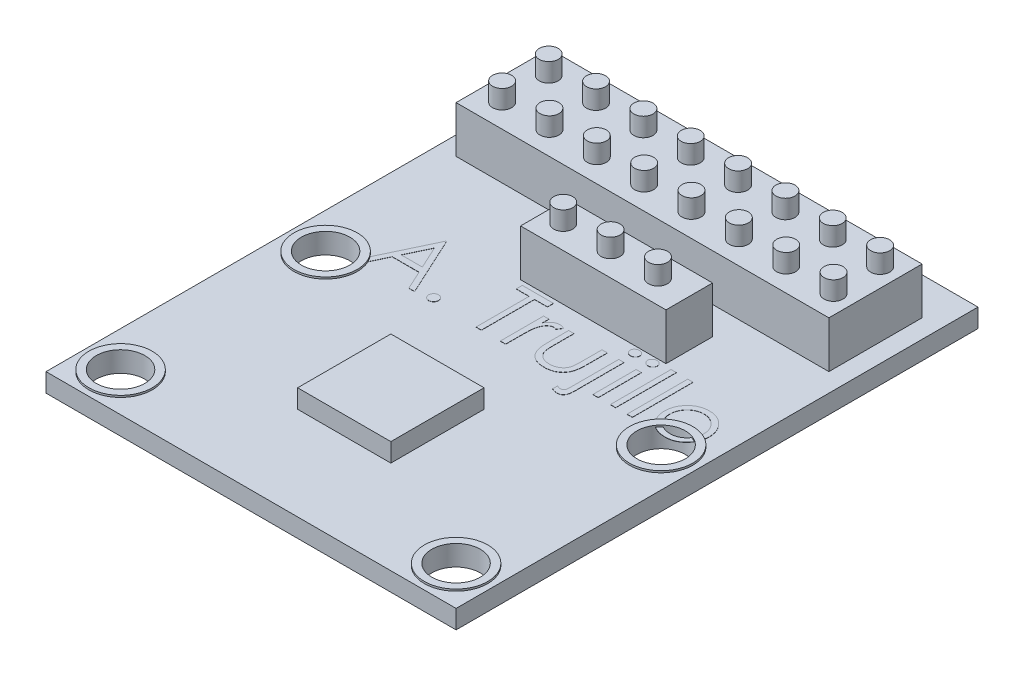
from build123d import *

# Parameters (mm, degrees)
SKETCH1_W           = 22
SKETCH1_H           = 28
BOSS_EXTRUDE1_DEPTH = 1
SKETCH2_W           = 20
SKETCH2_H           = 5
BOSS_EXTRUDE2_DEPTH = 2.5
SKETCH3_R           = 0.51
BOSS_EXTRUDE3_DEPTH = 1
SKETCH4_W           = 5
SKETCH4_H           = 5
BOSS_EXTRUDE4_DEPTH = 1
SKETCH5_R           = 1.3
CUT_EXTRUDE1_DEPTH  = 1
BOSS_EXTRUDE5_START = 0.1
SKETCH6_R           = 1.7
SKETCH6_R_2         = 1.3
BOSS_EXTRUDE5_DEPTH = 0.1
SKETCH7_W           = 7.8
SKETCH7_H           = 2.5
BOSS_EXTRUDE6_DEPTH = 2.5
SKETCH8_R           = 0.51
BOSS_EXTRUDE7_DEPTH = 1
SKETCH9_W           = 0.284935898
SKETCH9_H           = 2.320192308
SKETCH9_W_2         = 0.284935897
SKETCH9_H_2         = 3.256410256
BOSS_EXTRUDE8_DEPTH = 0.01


with BuildPart() as part:
    # Sketch1 → Boss-Extrude1 (new body)
    with BuildSketch(Plane(origin=(0, 0, 0), x_dir=(1, 0, 0), z_dir=(0, 1, 0))):
        Rectangle(SKETCH1_W, SKETCH1_H)
    extrude(amount=BOSS_EXTRUDE1_DEPTH)

    # Sketch2 → Boss-Extrude2 (add)
    with BuildSketch(Plane(origin=(0, 1, 0), x_dir=(1, 0, 0), z_dir=(0, 1, 0))):
        with Locations((0, 9.5)):
            Rectangle(SKETCH2_W, SKETCH2_H)
    extrude(amount=BOSS_EXTRUDE2_DEPTH)

    # Sketch3 → Boss-Extrude3 (add)
    with BuildSketch(Plane(origin=(0, 3.5, 0), x_dir=(1, 0, 0), z_dir=(0, 1, 0))):
        with Locations(Location((9, 8.25, 0), (0, 0, 270))):
            Circle(SKETCH3_R)
        with Locations(Location((6.46, 8.25, 0), (0, 0, 270))):
            Circle(SKETCH3_R)
        with Locations(Location((3.92, 8.25, 0), (0, 0, 270))):
            Circle(SKETCH3_R)
        with Locations(Location((1.38, 8.25, 0), (0, 0, 270))):
            Circle(SKETCH3_R)
        with Locations(Location((-1.16, 8.25, 0), (0, 0, 270))):
            Circle(SKETCH3_R)
        with Locations(Location((-3.7, 8.25, 0), (0, 0, 270))):
            Circle(SKETCH3_R)
        with Locations(Location((-6.24, 8.25, 0), (0, 0, 270))):
            Circle(SKETCH3_R)
        with Locations(Location((-8.78, 8.25, 0), (0, 0, 270))):
            Circle(SKETCH3_R)
        with Locations(Location((-8.78, 10.75, 0), (0, 0, 90))):
            Circle(SKETCH3_R)
        with Locations(Location((-6.24, 10.75, 0), (0, 0, 90))):
            Circle(SKETCH3_R)
        with Locations(Location((-3.7, 10.75, 0), (0, 0, 90))):
            Circle(SKETCH3_R)
        with Locations(Location((-1.16, 10.75, 0), (0, 0, 90))):
            Circle(SKETCH3_R)
        with Locations(Location((1.38, 10.75, 0), (0, 0, 90))):
            Circle(SKETCH3_R)
        with Locations(Location((3.92, 10.75, 0), (0, 0, 90))):
            Circle(SKETCH3_R)
        with Locations(Location((6.46, 10.75, 0), (0, 0, 90))):
            Circle(SKETCH3_R)
        with Locations(Location((9, 10.75, 0), (0, 0, 90))):
            Circle(SKETCH3_R)
    extrude(amount=BOSS_EXTRUDE3_DEPTH)

    # Sketch4 → Boss-Extrude4 (add)
    with BuildSketch(Plane(origin=(0, 1, 0), x_dir=(1, 0, 0), z_dir=(0, 1, 0))):
        with Locations((0, -6.5)):
            Rectangle(SKETCH4_W, SKETCH4_H)
    extrude(amount=BOSS_EXTRUDE4_DEPTH)

    # Sketch5 → Cut-Extrude1 (cut)
    with BuildSketch(Plane(origin=(0, 1, 0), x_dir=(1, 0, 0), z_dir=(0, 1, 0))):
        with Locations(Location((-9, -1, 0), (0, 0, 270))):
            Circle(SKETCH5_R)
        with Locations(Location((9, -1, 0), (0, 0, 90))):
            Circle(SKETCH5_R)
        with Locations(Location((9, -12, 0), (0, 0, 270))):
            Circle(SKETCH5_R)
        with Locations(Location((-9, -12, 0), (0, 0, 90))):
            Circle(SKETCH5_R)
    extrude(amount=-CUT_EXTRUDE1_DEPTH, mode=Mode.SUBTRACT)

    # Sketch6 → Boss-Extrude5 (add)
    # profile 1 of 4: a face of its own
    with BuildSketch(Plane(origin=(0, 1, 0), x_dir=(1, 0, 0), z_dir=(0, 1, 0)).offset(BOSS_EXTRUDE5_START)):
        with Locations(Location((-9, -1, 0), (0, 0, 270))):
            Circle(SKETCH6_R)
        with Locations(Location((-9, -1, 0), (0, 0, 270))):
            Circle(SKETCH6_R_2, mode=Mode.SUBTRACT)
    # profile 2 of 4: a face of its own
    with BuildSketch(Plane(origin=(0, 1, 0), x_dir=(1, 0, 0), z_dir=(0, 1, 0)).offset(BOSS_EXTRUDE5_START)):
        with Locations(Location((9, -1, 0), (0, 0, 270))):
            Circle(SKETCH6_R)
        with Locations(Location((9, -1, 0), (0, 0, 270))):
            Circle(SKETCH6_R_2, mode=Mode.SUBTRACT)
    # profile 3 of 4: a face of its own
    with BuildSketch(Plane(origin=(0, 1, 0), x_dir=(1, 0, 0), z_dir=(0, 1, 0)).offset(BOSS_EXTRUDE5_START)):
        with Locations(Location((-9, -12, 0), (0, 0, 270))):
            Circle(SKETCH6_R)
        with Locations(Location((-9, -12, 0), (0, 0, 270))):
            Circle(SKETCH6_R_2, mode=Mode.SUBTRACT)
    # profile 4 of 4: a face of its own
    with BuildSketch(Plane(origin=(0, 1, 0), x_dir=(1, 0, 0), z_dir=(0, 1, 0)).offset(BOSS_EXTRUDE5_START)):
        with Locations(Location((9, -12, 0), (0, 0, 270))):
            Circle(SKETCH6_R)
        with Locations(Location((9, -12, 0), (0, 0, 270))):
            Circle(SKETCH6_R_2, mode=Mode.SUBTRACT)
    extrude(amount=-BOSS_EXTRUDE5_DEPTH)

    # Sketch7 → Boss-Extrude6 (add)
    with BuildSketch(Plane(origin=(0, 1, 0), x_dir=(1, 0, 0), z_dir=(0, 1, 0))):
        with Locations((1.36, 4.25)):
            Rectangle(SKETCH7_W, SKETCH7_H)
    extrude(amount=BOSS_EXTRUDE6_DEPTH)

    # Sketch8 → Boss-Extrude7 (add)
    with BuildSketch(Plane(origin=(0, 3.5, 0), x_dir=(1, 0, 0), z_dir=(0, 1, 0))):
        with Locations(Location((-1.5, 4.25, 0), (0, 0, 270))):
            Circle(SKETCH8_R)
        with Locations(Location((1.04, 4.25, 0), (0, 0, 270))):
            Circle(SKETCH8_R)
        with Locations(Location((3.58, 4.25, 0), (0, 0, 270))):
            Circle(SKETCH8_R)
    extrude(amount=BOSS_EXTRUDE7_DEPTH)

    # Sketch9 → Boss-Extrude8 (add)
    # profile 1 of 12: a face of its own
    with BuildSketch(Plane(origin=(0, 1, 0), x_dir=(1, 0, 0), z_dir=(0, 1, 0))):
        Polygon((-6.290384615, 2.775), (-4.825, -0.4), (-5.134740585, -0.4), (-5.604121595, 0.617628205), (-7.043429487, 0.617628205), (-7.526166867, -0.4), (-7.837179487, -0.4), (-6.331089744, 2.775), align=None)
        Polygon((-6.313917268, 2.156154848), (-6.888877204, 0.943269231), (-5.754221755, 0.943269231), align=None, mode=Mode.SUBTRACT)
    # profile 2 of 12: a face of its own
    with BuildSketch(Plane(origin=(0, 1, 0), x_dir=(1, 0, 0), z_dir=(0, 1, 0))):
        with BuildLine():
            add(Edge.make_bspline(
                [(-4.03125, 0.088461538), (-4.013569593, 0.087410916), (-3.978909223, 0.085351293), (-3.928799442, 0.071221025), (-3.883447144, 0.046130668), (-3.843050036, 0.012690862), (-3.809752018, -0.027854489), (-3.783767498, -0.072845064), (-3.769760319, -0.123374365), (-3.767715699, -0.158235571), (-3.766666667, -0.176121795)],
                knots=[0, 0, 0, 0, 1.020151414, 1.999887582, 2.974338812, 3.990962822, 5.007586832, 5.987933904, 6.967670073, 8, 8, 8, 8], degree=3))
            add(Edge.make_bspline(
                [(-3.766666667, -0.176121795), (-3.767751247, -0.193578244), (-3.769890025, -0.228002105), (-3.78373539, -0.278150289), (-3.80995005, -0.323168981), (-3.842820365, -0.364264492), (-3.88345713, -0.397775139), (-3.928906662, -0.42265203), (-3.978791589, -0.437794041), (-4.013549968, -0.439722896), (-4.03125, -0.440705128)],
                knots=[0, 0, 0, 0, 1.009421747, 1.99056486, 2.972319754, 3.999869655, 5.017953583, 5.993804169, 6.978383603, 8, 8, 8, 8], degree=3))
            add(Edge.make_bspline(
                [(-4.03125, -0.440705128), (-4.048962786, -0.439758436), (-4.083542784, -0.437910246), (-4.133241507, -0.422341129), (-4.178967828, -0.398008419), (-4.219596681, -0.364202008), (-4.252742295, -0.323380449), (-4.277802464, -0.277840248), (-4.292852099, -0.228145659), (-4.294831369, -0.193606518), (-4.295833333, -0.176121795)],
                knots=[0, 0, 0, 0, 1.022052826, 1.995314843, 2.982371812, 4.00089066, 5.028879526, 6.005146991, 6.990147033, 8, 8, 8, 8], degree=3))
            add(Edge.make_bspline(
                [(-4.295833333, -0.176121795), (-4.294869858, -0.158206286), (-4.292988789, -0.123228454), (-4.277770869, -0.073154978), (-4.252936734, -0.027645037), (-4.219367554, 0.012629004), (-4.178977657, 0.0463632), (-4.133351814, 0.070914834), (-4.083423088, 0.085465779), (-4.048942644, 0.087445633), (-4.03125, 0.088461538)],
                knots=[0, 0, 0, 0, 1.032775665, 2.016367738, 2.991239715, 4.008302682, 5.025365648, 6.011011707, 6.979408107, 8, 8, 8, 8], degree=3))
        make_face()
    # profile 3 of 12: a face of its own
    with BuildSketch(Plane(origin=(0, 1, 0), x_dir=(1, 0, 0), z_dir=(0, 1, 0))):
        Polygon((-2.219871795, 2.449358974), (-2.219871795, 2.775), (-0.550961538, 2.775), (-0.550961538, 2.449358974), (-1.242948718, 2.449358974), (-1.242948718, -0.4), (-1.527884615, -0.4), (-1.527884615, 2.449358974), align=None)
    # profile 4 of 12: a face of its own
    with BuildSketch(Plane(origin=(0, 1, 0), x_dir=(1, 0, 0), z_dir=(0, 1, 0))):
        with BuildLine():
            Line((-0.225320513, 1.920192308), (0.059615385, 1.920192308))
            Line((0.059615385, 1.920192308), (0.059615385, 1.578650841))
            add(Edge.make_bspline(
                [(0.059615385, 1.578650841), (0.080650901, 1.610451486), (0.120881164, 1.671269971), (0.187749321, 1.751705694), (0.256241629, 1.818303629), (0.326685978, 1.871374678), (0.399600397, 1.911119436), (0.473384632, 1.940232403), (0.549199522, 1.957447539), (0.60014641, 1.95974593), (0.625671074, 1.960897436)],
                knots=[0, 0, 0, 0, 1.2804753, 2.448899062, 3.506932113, 4.484331642, 5.4025378, 6.288909075, 7.142734305, 8, 8, 8, 8], degree=3))
            add(Edge.make_bspline(
                [(0.625671074, 1.960897436), (0.64547067, 1.959817458), (0.686209626, 1.957595334), (0.747879547, 1.941982657), (0.811418964, 1.917056165), (0.852369558, 1.893615392), (0.873717949, 1.881395232)],
                knots=[0, 0, 0, 0, 0.901110191, 1.854092781, 2.881294221, 4, 4, 4, 4], degree=3))
            Line((0.873717949, 1.881395232), (0.717257612, 1.634620393))
            add(Edge.make_bspline(
                [(0.717257612, 1.634620393), (0.703551572, 1.640734777), (0.677534883, 1.652341049), (0.639476098, 1.666077015), (0.604386599, 1.674165024), (0.582031371, 1.675390318), (0.571609575, 1.675961538)],
                knots=[0, 0, 0, 0, 1.180555205, 2.24091978, 3.179933427, 4, 4, 4, 4], degree=3))
            add(Edge.make_bspline(
                [(0.571609575, 1.675961538), (0.548744374, 1.674437505), (0.502105992, 1.671328917), (0.433630767, 1.64689157), (0.367185088, 1.607407959), (0.31441508, 1.563619165), (0.273555322, 1.521393663), (0.244399546, 1.484519755), (0.217654483, 1.443173425), (0.192100069, 1.398061498), (0.168817073, 1.348413709), (0.147086766, 1.294726079), (0.127439083, 1.236936427), (0.116235648, 1.196675141), (0.110496795, 1.176051683)],
                knots=[0, 0, 0, 0, 1.125678352, 2.296057538, 3.5422874, 4.923748041, 5.663163013, 6.437101912, 7.23742474, 8.08941207, 8.991984279, 9.93940061, 10.944477711, 12, 12, 12, 12], degree=3))
            add(Edge.make_bspline(
                [(0.110496795, 1.176051683), (0.106203838, 1.15765739), (0.096695265, 1.116915428), (0.087450084, 1.048563552), (0.078315593, 0.967806376), (0.071877946, 0.874419109), (0.065910722, 0.768634964), (0.062545148, 0.650292785), (0.059730156, 0.519271102), (0.059654802, 0.427672938), (0.059615385, 0.379757612)],
                knots=[0, 0, 0, 0, 0.566838948, 1.255505196, 2.06880316, 3.007127437, 4.065329342, 5.249902469, 6.561414163, 8, 8, 8, 8], degree=3))
            Line((0.059615385, 0.379757612), (0.059615385, -0.4))
            Line((0.059615385, -0.4), (-0.225320513, -0.4))
            Line((-0.225320513, -0.4), (-0.225320513, 1.920192308))
        make_face()
    # profile 5 of 12: a face of its own
    with BuildSketch(Plane(origin=(0, 1, 0), x_dir=(1, 0, 0), z_dir=(0, 1, 0))):
        with BuildLine():
            Line((1.117948718, 1.920192308), (1.402884615, 1.920192308))
            Line((1.402884615, 1.920192308), (1.402884615, 0.844050481))
            add(Edge.make_bspline(
                [(1.402884615, 0.844050481), (1.403013343, 0.812461273), (1.403259594, 0.752032597), (1.40492959, 0.665078249), (1.408857604, 0.585778803), (1.413768716, 0.514088448), (1.420084368, 0.450019315), (1.42759856, 0.393795184), (1.435997271, 0.34477846), (1.444218447, 0.315256987), (1.448041867, 0.301527444)],
                knots=[0, 0, 0, 0, 1.388932606, 2.656963016, 3.823490214, 4.879454478, 5.816252168, 6.653371382, 7.373723809, 8, 8, 8, 8], degree=3))
            add(Edge.make_bspline(
                [(1.448041867, 0.301527444), (1.454175473, 0.284270982), (1.466315168, 0.250116817), (1.488334685, 0.200778219), (1.515574676, 0.155080642), (1.545383234, 0.111261947), (1.579763411, 0.070620145), (1.618280217, 0.033223867), (1.659644332, -0.002339845), (1.721107818, -0.044417477), (1.805163009, -0.089516384), (1.915519437, -0.128429019), (2.035175413, -0.15168437), (2.117874837, -0.154382444), (2.160381611, -0.155769231)],
                knots=[0, 0, 0, 0, 0.725840625, 1.436591201, 2.137033971, 2.831655856, 3.53531722, 4.242432219, 4.957935707, 5.694543706, 7.190802206, 8.724350549, 10.316345118, 12, 12, 12, 12], degree=3))
            add(Edge.make_bspline(
                [(2.160381611, -0.155769231), (2.202884435, -0.154352955), (2.285119537, -0.151612724), (2.403460831, -0.129130514), (2.5116389, -0.091569639), (2.608567977, -0.039130058), (2.693808418, 0.025043099), (2.764841712, 0.100343946), (2.823449721, 0.184390176), (2.849039696, 0.247095772), (2.861909054, 0.278630809)],
                knots=[0, 0, 0, 0, 1.157059328, 2.238695713, 3.266970494, 4.264342957, 5.228770407, 6.160125903, 7.074715775, 8, 8, 8, 8], degree=3))
            add(Edge.make_bspline(
                [(2.861909054, 0.278630809), (2.86571382, 0.291300237), (2.874125228, 0.319309249), (2.883162504, 0.366825163), (2.891303623, 0.423489483), (2.898255219, 0.489673001), (2.903212902, 0.565202761), (2.905885369, 0.650055158), (2.90890459, 0.743963821), (2.908950415, 0.809702431), (2.908974359, 0.844050481)],
                knots=[0, 0, 0, 0, 0.557542046, 1.232589297, 2.036731608, 2.971723315, 4.038036528, 5.22795436, 6.551621927, 8, 8, 8, 8], degree=3))
            Line((2.908974359, 0.844050481), (2.908974359, 1.920192308))
            Line((2.908974359, 1.920192308), (3.193910256, 1.920192308))
            Line((3.193910256, 1.920192308), (3.193910256, 0.790625))
            add(Edge.make_bspline(
                [(3.193910256, 0.790625), (3.193509576, 0.752246352), (3.192732202, 0.677786524), (3.187736254, 0.569578794), (3.179164106, 0.468738758), (3.166153241, 0.375213037), (3.150853665, 0.289073036), (3.131117617, 0.210208352), (3.107551645, 0.138861971), (3.080967356, 0.073781931), (3.049560376, 0.014775105), (3.016153008, -0.0412281), (2.977576965, -0.092838119), (2.936963966, -0.142624058), (2.89178675, -0.188109587), (2.842891878, -0.230338425), (2.790967547, -0.269956104), (2.734861489, -0.305417479), (2.675392775, -0.337364007), (2.61248799, -0.36568145), (2.545376656, -0.388090216), (2.474924642, -0.407422034), (2.400786778, -0.422584446), (2.323034536, -0.433276545), (2.241694106, -0.439830953), (2.186259096, -0.440408843), (2.15783754, -0.440705128)],
                knots=[0, 0, 0, 0, 1.493040784, 2.896703357, 4.213163133, 5.428574705, 6.569057535, 7.615249723, 8.588095153, 9.490268104, 10.346124644, 11.18633936, 12.024365274, 12.850166724, 13.684164916, 14.514361689, 15.362232829, 16.222528818, 17.093394965, 17.986930858, 18.902426812, 19.842810585, 20.827885679, 21.843828298, 22.894529745, 24, 24, 24, 24], degree=3))
            add(Edge.make_bspline(
                [(2.15783754, -0.440705128), (2.129628559, -0.440396965), (2.074195286, -0.439791396), (1.992850658, -0.433312757), (1.914882993, -0.422601059), (1.840569489, -0.407310969), (1.769835571, -0.388225527), (1.702394725, -0.365543748), (1.639036636, -0.337349311), (1.579000104, -0.30561967), (1.52275508, -0.269728313), (1.470042299, -0.230387306), (1.42093244, -0.187655377), (1.375414671, -0.141710989), (1.334127899, -0.091984196), (1.296557633, -0.03887501), (1.262125479, 0.017090342), (1.23096259, 0.077019068), (1.204191212, 0.142852249), (1.180555382, 0.215693187), (1.161223589, 0.29634047), (1.145491492, 0.384725148), (1.132835543, 0.480424221), (1.124048828, 0.583991284), (1.119135896, 0.695174061), (1.118352976, 0.771963605), (1.117948718, 0.811613582)],
                knots=[0, 0, 0, 0, 1.083640291, 2.129454052, 3.13281866, 4.105697902, 5.042300162, 5.946461698, 6.836384745, 7.703652036, 8.553297018, 9.397182691, 10.228592656, 11.052265423, 11.879314572, 12.708807002, 13.549817954, 14.402308542, 15.300838682, 16.27712199, 17.341985831, 18.484375296, 19.725102775, 21.0496083, 22.476576903, 24, 24, 24, 24], degree=3))
            Line((1.117948718, 0.811613582), (1.117948718, 1.920192308))
        make_face()
    # profile 6 of 12: a face of its own
    with BuildSketch(Plane(origin=(0, 1, 0), x_dir=(1, 0, 0), z_dir=(0, 1, 0))):
        with BuildLine():
            add(Edge.make_bspline(
                [(3.946955128, 2.897115385), (3.964844632, 2.896301242), (3.999673067, 2.894716217), (4.049844476, 2.881099846), (4.094985299, 2.857386423), (4.135408102, 2.826583645), (4.169313863, 2.789305864), (4.193927924, 2.746840161), (4.208489214, 2.700234886), (4.210508366, 2.668038142), (4.211538462, 2.65161258)],
                knots=[0, 0, 0, 0, 1.06928763, 2.081757757, 3.080304056, 4.102817284, 5.108909582, 6.075019406, 7.017947647, 8, 8, 8, 8], degree=3))
            add(Edge.make_bspline(
                [(4.211538462, 2.65161258), (4.210488325, 2.63561376), (4.20841659, 2.604050893), (4.193938765, 2.558247277), (4.169108267, 2.516376936), (4.135430802, 2.479171593), (4.09497934, 2.448386481), (4.04984607, 2.424668402), (3.999672639, 2.411053277), (3.964844487, 2.409468078), (3.946955128, 2.408653846)],
                knots=[0, 0, 0, 0, 0.962634111, 1.899108286, 2.860048811, 3.872254101, 4.900980094, 5.905593535, 6.924215405, 8, 8, 8, 8], degree=3))
            add(Edge.make_bspline(
                [(3.946955128, 2.408653846), (3.929065769, 2.409468078), (3.894237617, 2.411053277), (3.844064186, 2.424668402), (3.798930916, 2.448386481), (3.758479455, 2.479171593), (3.72480199, 2.516376936), (3.699971492, 2.558247277), (3.685493667, 2.604050893), (3.683421931, 2.63561376), (3.682371795, 2.65161258)],
                knots=[0, 0, 0, 0, 1.075784595, 2.094406465, 3.099019906, 4.127745899, 5.139951189, 6.100891714, 7.037365889, 8, 8, 8, 8], degree=3))
            add(Edge.make_bspline(
                [(3.682371795, 2.65161258), (3.68340189, 2.668038142), (3.685421042, 2.700234886), (3.699982332, 2.746840161), (3.724596393, 2.789305864), (3.758502154, 2.826583645), (3.798924958, 2.857386423), (3.844065781, 2.881099846), (3.89423719, 2.894716217), (3.929065624, 2.896301242), (3.946955128, 2.897115385)],
                knots=[0, 0, 0, 0, 0.982052353, 1.924980594, 2.891090418, 3.897182716, 4.919695944, 5.918242243, 6.93071237, 8, 8, 8, 8], degree=3))
        make_face()
    # profile 7 of 12: a face of its own
    with BuildSketch(Plane(origin=(0, 1, 0), x_dir=(1, 0, 0), z_dir=(0, 1, 0))):
        with BuildLine():
            Line((3.804487179, 1.920192308), (4.089423077, 1.920192308))
            Line((4.089423077, 1.920192308), (4.089423077, -0.738997396))
            add(Edge.make_bspline(
                [(4.089423077, -0.738997396), (4.089332128, -0.762543685), (4.089157362, -0.807790032), (4.08355857, -0.873126571), (4.076295731, -0.933703109), (4.065705325, -0.989449357), (4.051692947, -1.040319581), (4.034491536, -1.085988372), (4.015142869, -1.127421868), (3.991180759, -1.163108424), (3.965126068, -1.194427666), (3.936750989, -1.221527429), (3.906210926, -1.244748826), (3.872788376, -1.262979637), (3.837570782, -1.278101428), (3.799803261, -1.287846972), (3.760003002, -1.294698271), (3.73264868, -1.295236754), (3.7186248, -1.295512821)],
                knots=[0, 0, 0, 0, 1.493029139, 2.868991889, 4.156754484, 5.362105958, 6.464967428, 7.499106053, 8.455465818, 9.358121702, 10.217355437, 11.035397588, 11.842309395, 12.643033568, 13.444773531, 14.266895717, 15.11148054, 16, 16, 16, 16], degree=3))
            add(Edge.make_bspline(
                [(3.7186248, -1.295512821), (3.693966134, -1.294660842), (3.643002913, -1.292900019), (3.564737446, -1.277501864), (3.481894906, -1.254874533), (3.426311346, -1.233483404), (3.397435897, -1.222370793)],
                knots=[0, 0, 0, 0, 0.892368802, 1.844300437, 2.88012224, 4, 4, 4, 4], degree=3))
            Line((3.397435897, -1.222370793), (3.397435897, -0.948247196))
            add(Edge.make_bspline(
                [(3.397435897, -0.948247196), (3.41545271, -0.957855682), (3.449830753, -0.976189721), (3.50244422, -0.994748605), (3.551728083, -1.008347444), (3.584131659, -1.009853719), (3.599689503, -1.010576923)],
                knots=[0, 0, 0, 0, 1.144578483, 2.183980519, 3.128079311, 4, 4, 4, 4], degree=3))
            add(Edge.make_bspline(
                [(3.599689503, -1.010576923), (3.617677073, -1.009421716), (3.652367083, -1.007193836), (3.700738004, -0.987968404), (3.741514316, -0.955337613), (3.76033218, -0.926010723), (3.770142228, -0.910722155)],
                knots=[0, 0, 0, 0, 1.036054724, 1.998088038, 2.956371939, 4, 4, 4, 4], degree=3))
            add(Edge.make_bspline(
                [(3.770142228, -0.910722155), (3.775712416, -0.897297287), (3.788746637, -0.86588314), (3.797650118, -0.807107044), (3.803895746, -0.732378348), (3.804277615, -0.676696339), (3.804487179, -0.646138822)],
                knots=[0, 0, 0, 0, 0.647276487, 1.514624746, 2.636060416, 4, 4, 4, 4], degree=3))
            Line((3.804487179, -0.646138822), (3.804487179, 1.920192308))
        make_face()
    # profile 8 of 12: a face of its own
    with BuildSketch(Plane(origin=(0, 1, 0), x_dir=(1, 0, 0), z_dir=(0, 1, 0))):
        with BuildLine():
            add(Edge.make_bspline(
                [(4.881901042, 2.897115385), (4.89958245, 2.896295189), (4.934206042, 2.894689089), (4.984274221, 2.880935463), (5.02986451, 2.857622177), (5.070302882, 2.826344181), (5.105002808, 2.789560043), (5.129296738, 2.746687593), (5.14491084, 2.700370114), (5.146796387, 2.66806214), (5.14775641, 2.65161258)],
                knots=[0, 0, 0, 0, 1.055194115, 2.066272739, 3.074728998, 4.095836921, 5.109056067, 6.073838105, 7.019297344, 8, 8, 8, 8], degree=3))
            add(Edge.make_bspline(
                [(5.14775641, 2.65161258), (5.146774737, 2.63559003), (5.144834084, 2.603915346), (5.129308798, 2.558400839), (5.104795768, 2.516124096), (5.070325133, 2.479411381), (5.029858614, 2.448150675), (4.984275787, 2.424832805), (4.93420563, 2.411080395), (4.89958231, 2.409474127), (4.881901042, 2.408653846)],
                knots=[0, 0, 0, 0, 0.96129708, 1.900370562, 2.859976407, 3.87933698, 4.906634145, 5.921202961, 6.938410037, 8, 8, 8, 8], degree=3))
            add(Edge.make_bspline(
                [(4.881901042, 2.408653846), (4.864421963, 2.409442807), (4.830401221, 2.410978415), (4.781082729, 2.425102646), (4.735881171, 2.448158655), (4.695363932, 2.479206694), (4.661590828, 2.516349565), (4.637008776, 2.558375039), (4.621519346, 2.603921915), (4.619573861, 2.635592237), (4.618589744, 2.65161258)],
                knots=[0, 0, 0, 0, 1.054934014, 2.053291228, 3.073705704, 4.106921865, 5.123545215, 6.088680038, 7.033164197, 8, 8, 8, 8], degree=3))
            add(Edge.make_bspline(
                [(4.618589744, 2.65161258), (4.619552301, 2.668059851), (4.621442824, 2.700363328), (4.637020386, 2.746713822), (4.661386069, 2.789332756), (4.695386294, 2.826548745), (4.735875219, 2.857614247), (4.781084267, 2.880665637), (4.830400815, 2.894791066), (4.864421826, 2.896326509), (4.881901042, 2.897115385)],
                knots=[0, 0, 0, 0, 0.98631895, 1.937192651, 2.907499808, 3.917963147, 4.944918757, 5.95915025, 6.951458133, 8, 8, 8, 8], degree=3))
        make_face()
    # profile 9 of 12: a face of its own
    with BuildSketch(Plane(origin=(0, 1, 0), x_dir=(1, 0, 0), z_dir=(0, 1, 0))):
        with Locations((4.883173077, 0.760096154)):
            Rectangle(SKETCH9_W, SKETCH9_H)
    # profile 10 of 12: a face of its own
    with BuildSketch(Plane(origin=(0, 1, 0), x_dir=(1, 0, 0), z_dir=(0, 1, 0))):
        with Locations((5.819391025, 1.228205128)):
            Rectangle(SKETCH9_W_2, SKETCH9_H_2)
    # profile 11 of 12: a face of its own
    with BuildSketch(Plane(origin=(0, 1, 0), x_dir=(1, 0, 0), z_dir=(0, 1, 0))):
        with Locations((6.714903846, 1.228205128)):
            Rectangle(SKETCH9_W, SKETCH9_H_2)
    # profile 12 of 12: a face of its own
    with BuildSketch(Plane(origin=(0, 1, 0), x_dir=(1, 0, 0), z_dir=(0, 1, 0))):
        with BuildLine():
            add(Edge.make_bspline(
                [(8.629316907, 1.960897436), (8.672851847, 1.959970435), (8.758213226, 1.958152812), (8.883224665, 1.938726379), (9.002554896, 1.909019841), (9.116660942, 1.867952067), (9.224081438, 1.812904869), (9.326381067, 1.747219298), (9.423279353, 1.669402231), (9.481357387, 1.609205983), (9.51083734, 1.578650841)],
                knots=[0, 0, 0, 0, 1.054011418, 2.066658804, 3.057071809, 4.030435133, 4.997543892, 5.974964718, 6.972108034, 8, 8, 8, 8], degree=3))
            add(Edge.make_bspline(
                [(9.51083734, 1.578650841), (9.53622097, 1.549428154), (9.586496986, 1.49154832), (9.650963745, 1.397699299), (9.706500446, 1.300507922), (9.751007561, 1.198683562), (9.786100404, 1.09311511), (9.811015714, 0.983439714), (9.825835648, 0.869899585), (9.827834053, 0.79278896), (9.828846154, 0.753735978)],
                knots=[0, 0, 0, 0, 1.025258237, 2.030674902, 3.01204498, 3.988269485, 4.97094183, 5.956517959, 6.965070386, 8, 8, 8, 8], degree=3))
            add(Edge.make_bspline(
                [(9.828846154, 0.753735978), (9.827955941, 0.71445664), (9.826196838, 0.636838836), (9.809556557, 0.522521268), (9.783674787, 0.411673108), (9.746634476, 0.304758435), (9.699138192, 0.201450442), (9.641180211, 0.102200351), (9.572353815, 0.006812344), (9.494335904, -0.083903609), (9.408110273, -0.167511532), (9.314569196, -0.240380748), (9.215550894, -0.302811703), (9.109738709, -0.353100451), (8.998098917, -0.392751394), (8.88039072, -0.420600694), (8.756796978, -0.437438793), (8.672407998, -0.439601034), (8.629316907, -0.440705128)],
                knots=[0, 0, 0, 0, 0.998656419, 1.973391657, 2.932242238, 3.890759089, 4.846373663, 5.82037756, 6.809684879, 7.83454468, 8.860553229, 9.859544525, 10.845671541, 11.83227036, 12.833544569, 13.85385346, 14.904124723, 16, 16, 16, 16], degree=3))
            add(Edge.make_bspline(
                [(8.629316907, -0.440705128), (8.586014697, -0.439597329), (8.501205132, -0.437427648), (8.377175134, -0.420666113), (8.259255979, -0.392764228), (8.147470036, -0.352970146), (8.041202925, -0.302810095), (7.941610889, -0.240569491), (7.847993823, -0.167489922), (7.761749951, -0.083909465), (7.68373693, 0.006813853), (7.614909273, 0.102199959), (7.55695162, 0.201450544), (7.509455249, 0.304758408), (7.472414962, 0.411673115), (7.446533185, 0.522521266), (7.429892906, 0.636838836), (7.428133803, 0.71445664), (7.42724359, 0.753735978)],
                knots=[0, 0, 0, 0, 1.099876186, 2.154163076, 3.173186993, 4.173200201, 5.163417411, 6.152872554, 7.150605724, 8.17532212, 9.198891216, 10.186952605, 11.159729845, 12.11414092, 13.071450619, 14.029093627, 15.002601286, 16, 16, 16, 16], degree=3))
            add(Edge.make_bspline(
                [(7.42724359, 0.753735978), (7.428262593, 0.792576701), (7.430280043, 0.869474659), (7.445085077, 0.98280135), (7.469903196, 1.092291124), (7.505038105, 1.197452092), (7.549955457, 1.298830237), (7.604711768, 1.396261763), (7.669836128, 1.48968641), (7.719912184, 1.54749144), (7.745252404, 1.576742788)],
                knots=[0, 0, 0, 0, 1.031353054, 2.041901799, 3.029428768, 4.008703097, 4.981709435, 5.96992636, 6.972712378, 8, 8, 8, 8], degree=3))
            add(Edge.make_bspline(
                [(7.745252404, 1.576742788), (7.774687911, 1.607562912), (7.832578016, 1.668176108), (7.929958648, 1.745766326), (8.032006614, 1.812818764), (8.140614226, 1.866772189), (8.254626533, 1.909261415), (8.374568274, 1.93880299), (8.50000392, 1.958082819), (8.585783005, 1.95994988), (8.629316907, 1.960897436)],
                knots=[0, 0, 0, 0, 1.027980169, 2.021703884, 2.998553061, 3.971491411, 4.943284454, 5.930300938, 6.949603206, 8, 8, 8, 8], degree=3))
        make_face()
        with BuildLine():
            add(Edge.make_bspline(
                [(8.628044872, 1.675961538), (8.59725861, 1.675086516), (8.536480829, 1.67335906), (8.447018777, 1.660220089), (8.360894495, 1.639403425), (8.277944586, 1.609826888), (8.19844878, 1.571637172), (8.122330965, 1.524730303), (8.049367251, 1.469727549), (7.980984951, 1.406714983), (7.918226711, 1.337881895), (7.863364546, 1.264540884), (7.816714628, 1.187881555), (7.777852484, 1.107824192), (7.748908106, 1.023557503), (7.727886865, 0.936035787), (7.714760289, 0.845080731), (7.713049074, 0.78324895), (7.712179487, 0.751827925)],
                knots=[0, 0, 0, 0, 1.021534396, 2.016698045, 2.994645724, 3.958388632, 4.93408049, 5.916473867, 6.921342795, 7.962252576, 8.998418191, 10.008913653, 10.997312074, 11.973003931, 12.956656626, 13.948281152, 14.957379055, 16, 16, 16, 16], degree=3))
            add(Edge.make_bspline(
                [(7.712179487, 0.751827925), (7.713637106, 0.711231443), (7.716530206, 0.630655018), (7.740057171, 0.511990642), (7.779414724, 0.398069962), (7.832561757, 0.289560812), (7.899151684, 0.189165246), (7.977607808, 0.099656113), (8.067088108, 0.022380413), (8.166525933, -0.041737211), (8.273890207, -0.092682133), (8.387515584, -0.128785489), (8.506025357, -0.15225481), (8.587015734, -0.154587505), (8.628044872, -0.155769231)],
                knots=[0, 0, 0, 0, 1.016792936, 2.018143844, 3.017858371, 4.030088057, 5.03801393, 6.028138512, 7.003788237, 7.991172063, 8.984598303, 9.972568034, 10.972917682, 12, 12, 12, 12], degree=3))
            add(Edge.make_bspline(
                [(8.628044872, -0.155769231), (8.669071649, -0.154580619), (8.750057369, -0.152234334), (8.868402479, -0.12890369), (8.981717296, -0.092523941), (9.088970055, -0.041794507), (9.188362617, 0.022623898), (9.278486462, 0.099219754), (9.356272703, 0.189402319), (9.422796758, 0.289693792), (9.476814161, 0.39790174), (9.515987494, 0.512011668), (9.539571018, 0.630649663), (9.542456484, 0.711229649), (9.543910256, 0.751827925)],
                knots=[0, 0, 0, 0, 1.02726834, 2.027799167, 3.010890988, 4.004497153, 4.992059811, 5.971914811, 6.958719428, 7.966827853, 8.981595046, 9.981490638, 10.983022906, 12, 12, 12, 12], degree=3))
            add(Edge.make_bspline(
                [(9.543910256, 0.751827925), (9.543040969, 0.783249138), (9.541330343, 0.845081288), (9.528199482, 0.936033657), (9.5071941, 1.023565319), (9.478191276, 1.107795351), (9.439497992, 1.188088837), (9.391948472, 1.264315804), (9.337310328, 1.338135956), (9.273794797, 1.406492473), (9.205483875, 1.469752114), (9.132490591, 1.524751631), (9.056485646, 1.571431021), (8.977220789, 1.61015354), (8.894260245, 1.639134341), (8.808256635, 1.660340285), (8.719176286, 1.673303535), (8.658616297, 1.675069871), (8.628044872, 1.675961538)],
                knots=[0, 0, 0, 0, 1.042956736, 2.052379634, 3.044323526, 4.02829302, 5.004299113, 5.996692471, 7.007513377, 8.048758398, 9.090003419, 10.095195979, 11.07790575, 12.047570684, 13.018257071, 13.989683339, 14.985167495, 16, 16, 16, 16], degree=3))
        make_face(mode=Mode.SUBTRACT)
    extrude(amount=BOSS_EXTRUDE8_DEPTH)


solid = part.part
